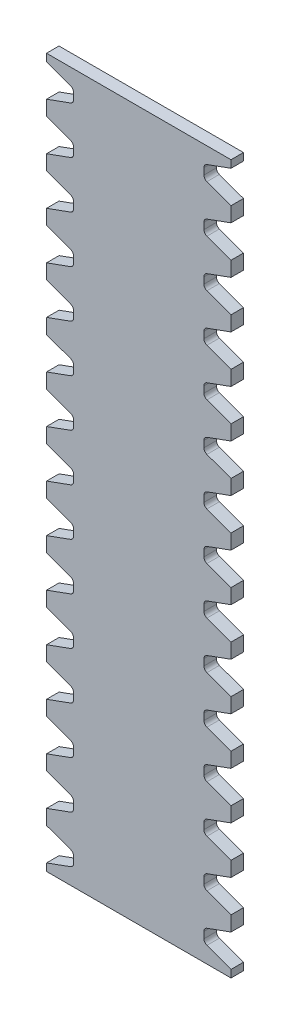
from build123d import *

# Parameters (mm, degrees)
SKETCHCI_M_STRSKETCHNAME_W         = 59.081695238
SKETCHCI_M_STRSKETCHNAME_H         = 453.902916577
EXTRUDECI_DEPTH                    = 4
TOOTHEXTRUDECUTGEARTRAX1GEAR_DEPTH = 4
PATTERNGEARTRAX1GEAR_COUNT         = 15
PATTERNGEARTRAX1GEAR_PITCH         = 30.260194893
MIRROR1_COPY_1_DEPTH               = 4
MIRROR1_COPY_2_DEPTH               = 4
MIRROR1_COPY_3_DEPTH               = 4
MIRROR1_COPY_4_DEPTH               = 4
MIRROR1_COPY_5_DEPTH               = 4
MIRROR1_COPY_6_DEPTH               = 4
MIRROR1_COPY_7_DEPTH               = 4
MIRROR1_COPY_8_DEPTH               = 4
MIRROR1_COPY_9_DEPTH               = 4
MIRROR1_COPY_10_DEPTH              = 4
MIRROR1_COPY_11_DEPTH              = 4
MIRROR1_COPY_12_DEPTH              = 4
MIRROR1_COPY_13_DEPTH              = 4
MIRROR1_COPY_14_DEPTH              = 4


with BuildPart() as part:
    # SketchCI.m_strSketchName → ExtrudeCI (new, symmetric)
    with BuildSketch(Plane.XY):
        with Locations((21.835152381, -211.82136107)):
            Rectangle(SKETCHCI_M_STRSKETCHNAME_W, SKETCHCI_M_STRSKETCHNAME_H)
    extrudeci = extrude(amount=EXTRUDECI_DEPTH, both=True)

    # SketchToothGeartrax1Gear → ToothExtrudeCutGeartrax1Gear (cut, symmetric)
    with BuildSketch(Plane.XY):
        with BuildLine():
            Line((-7.705695238, 10.369692311), (-7.705695238, -10.369692311))
            Line((-7.705695238, -10.369692311), (7.730796954, -4.751268631))
            ThreePointArc((7.730796954, -4.751268631), (9.109534336, -3.693326229), (9.632119048, -2.035899274))
            Line((9.632119048, -2.035899274), (9.632119048, 2.035899274))
            ThreePointArc((9.632119048, 2.035899274), (9.109534336, 3.693326229), (7.730796954, 4.751268631))
            Line((7.730796954, 4.751268631), (-7.705695238, 10.369692311))
        make_face()
    toothextrudecutgeartrax1gear = extrude(amount=TOOTHEXTRUDECUTGEARTRAX1GEAR_DEPTH, both=True, mode=Mode.SUBTRACT)

    # PatternGeartrax1Gear: ToothExtrudeCutGeartrax1Gear ×15
    with Locations(*[(0, -i * PATTERNGEARTRAX1GEAR_PITCH, 0) for i in range(1, PATTERNGEARTRAX1GEAR_COUNT)]):
        add(toothextrudecutgeartrax1gear, mode=Mode.SUBTRACT)

    # Mirror1: ExtrudeCI, ToothExtrudeCutGeartrax1Gear across plane
    add(extrudeci.mirror(Plane(origin=(51.376, -438.772819358, -4), x_dir=(0, 0, 1), z_dir=(1, 0, 0))))
    add(toothextrudecutgeartrax1gear.mirror(Plane(origin=(51.376, -438.772819358, -4), x_dir=(0, 0, 1), z_dir=(1, 0, 0))), mode=Mode.SUBTRACT)

    # Mirror1 copy 1 sketch → Mirror1 copy 1 (cut, symmetric)
    with BuildSketch(Plane(origin=(102.752, -30.260194893, 0), x_dir=(-1, 0, 0), z_dir=(0, 0, 1))):
        with BuildLine():
            Line((-7.705695238, -10.369692311), (-7.705695238, 10.369692311))
            Line((-7.705695238, 10.369692311), (7.730796954, 4.751268631))
            ThreePointArc((7.730796954, 4.751268631), (9.109534336, 3.693326229), (9.632119048, 2.035899274))
            Line((9.632119048, 2.035899274), (9.632119048, -2.035899274))
            ThreePointArc((9.632119048, -2.035899274), (9.109534336, -3.693326229), (7.730796954, -4.751268631))
            Line((7.730796954, -4.751268631), (-7.705695238, -10.369692311))
        make_face()
    extrude(amount=MIRROR1_COPY_1_DEPTH, both=True, mode=Mode.SUBTRACT)

    # Mirror1 copy 2 sketch → Mirror1 copy 2 (cut, symmetric)
    with BuildSketch(Plane(origin=(102.752, -60.520389786, 0), x_dir=(-1, 0, 0), z_dir=(0, 0, 1))):
        with BuildLine():
            Line((-7.705695238, -10.369692311), (-7.705695238, 10.369692311))
            Line((-7.705695238, 10.369692311), (7.730796954, 4.751268631))
            ThreePointArc((7.730796954, 4.751268631), (9.109534336, 3.693326229), (9.632119048, 2.035899274))
            Line((9.632119048, 2.035899274), (9.632119048, -2.035899274))
            ThreePointArc((9.632119048, -2.035899274), (9.109534336, -3.693326229), (7.730796954, -4.751268631))
            Line((7.730796954, -4.751268631), (-7.705695238, -10.369692311))
        make_face()
    extrude(amount=MIRROR1_COPY_2_DEPTH, both=True, mode=Mode.SUBTRACT)

    # Mirror1 copy 3 sketch → Mirror1 copy 3 (cut, symmetric)
    with BuildSketch(Plane(origin=(102.752, -90.780584679, 0), x_dir=(-1, 0, 0), z_dir=(0, 0, 1))):
        with BuildLine():
            Line((-7.705695238, -10.369692311), (-7.705695238, 10.369692311))
            Line((-7.705695238, 10.369692311), (7.730796954, 4.751268631))
            ThreePointArc((7.730796954, 4.751268631), (9.109534336, 3.693326229), (9.632119048, 2.035899274))
            Line((9.632119048, 2.035899274), (9.632119048, -2.035899274))
            ThreePointArc((9.632119048, -2.035899274), (9.109534336, -3.693326229), (7.730796954, -4.751268631))
            Line((7.730796954, -4.751268631), (-7.705695238, -10.369692311))
        make_face()
    extrude(amount=MIRROR1_COPY_3_DEPTH, both=True, mode=Mode.SUBTRACT)

    # Mirror1 copy 4 sketch → Mirror1 copy 4 (cut, symmetric)
    with BuildSketch(Plane(origin=(102.752, -121.040779572, 0), x_dir=(-1, 0, 0), z_dir=(0, 0, 1))):
        with BuildLine():
            Line((-7.705695238, -10.369692311), (-7.705695238, 10.369692311))
            Line((-7.705695238, 10.369692311), (7.730796954, 4.751268631))
            ThreePointArc((7.730796954, 4.751268631), (9.109534336, 3.693326229), (9.632119048, 2.035899274))
            Line((9.632119048, 2.035899274), (9.632119048, -2.035899274))
            ThreePointArc((9.632119048, -2.035899274), (9.109534336, -3.693326229), (7.730796954, -4.751268631))
            Line((7.730796954, -4.751268631), (-7.705695238, -10.369692311))
        make_face()
    extrude(amount=MIRROR1_COPY_4_DEPTH, both=True, mode=Mode.SUBTRACT)

    # Mirror1 copy 5 sketch → Mirror1 copy 5 (cut, symmetric)
    with BuildSketch(Plane(origin=(102.752, -151.300974465, 0), x_dir=(-1, 0, 0), z_dir=(0, 0, 1))):
        with BuildLine():
            Line((-7.705695238, -10.369692311), (-7.705695238, 10.369692311))
            Line((-7.705695238, 10.369692311), (7.730796954, 4.751268631))
            ThreePointArc((7.730796954, 4.751268631), (9.109534336, 3.693326229), (9.632119048, 2.035899274))
            Line((9.632119048, 2.035899274), (9.632119048, -2.035899274))
            ThreePointArc((9.632119048, -2.035899274), (9.109534336, -3.693326229), (7.730796954, -4.751268631))
            Line((7.730796954, -4.751268631), (-7.705695238, -10.369692311))
        make_face()
    extrude(amount=MIRROR1_COPY_5_DEPTH, both=True, mode=Mode.SUBTRACT)

    # Mirror1 copy 6 sketch → Mirror1 copy 6 (cut, symmetric)
    with BuildSketch(Plane(origin=(102.752, -181.561169358, 0), x_dir=(-1, 0, 0), z_dir=(0, 0, 1))):
        with BuildLine():
            Line((-7.705695238, -10.369692311), (-7.705695238, 10.369692311))
            Line((-7.705695238, 10.369692311), (7.730796954, 4.751268631))
            ThreePointArc((7.730796954, 4.751268631), (9.109534336, 3.693326229), (9.632119048, 2.035899274))
            Line((9.632119048, 2.035899274), (9.632119048, -2.035899274))
            ThreePointArc((9.632119048, -2.035899274), (9.109534336, -3.693326229), (7.730796954, -4.751268631))
            Line((7.730796954, -4.751268631), (-7.705695238, -10.369692311))
        make_face()
    extrude(amount=MIRROR1_COPY_6_DEPTH, both=True, mode=Mode.SUBTRACT)

    # Mirror1 copy 7 sketch → Mirror1 copy 7 (cut, symmetric)
    with BuildSketch(Plane(origin=(102.752, -211.821364251, 0), x_dir=(-1, 0, 0), z_dir=(0, 0, 1))):
        with BuildLine():
            Line((-7.705695238, -10.369692311), (-7.705695238, 10.369692311))
            Line((-7.705695238, 10.369692311), (7.730796954, 4.751268631))
            ThreePointArc((7.730796954, 4.751268631), (9.109534336, 3.693326229), (9.632119048, 2.035899274))
            Line((9.632119048, 2.035899274), (9.632119048, -2.035899274))
            ThreePointArc((9.632119048, -2.035899274), (9.109534336, -3.693326229), (7.730796954, -4.751268631))
            Line((7.730796954, -4.751268631), (-7.705695238, -10.369692311))
        make_face()
    extrude(amount=MIRROR1_COPY_7_DEPTH, both=True, mode=Mode.SUBTRACT)

    # Mirror1 copy 8 sketch → Mirror1 copy 8 (cut, symmetric)
    with BuildSketch(Plane(origin=(102.752, -242.081559144, 0), x_dir=(-1, 0, 0), z_dir=(0, 0, 1))):
        with BuildLine():
            Line((-7.705695238, -10.369692311), (-7.705695238, 10.369692311))
            Line((-7.705695238, 10.369692311), (7.730796954, 4.751268631))
            ThreePointArc((7.730796954, 4.751268631), (9.109534336, 3.693326229), (9.632119048, 2.035899274))
            Line((9.632119048, 2.035899274), (9.632119048, -2.035899274))
            ThreePointArc((9.632119048, -2.035899274), (9.109534336, -3.693326229), (7.730796954, -4.751268631))
            Line((7.730796954, -4.751268631), (-7.705695238, -10.369692311))
        make_face()
    extrude(amount=MIRROR1_COPY_8_DEPTH, both=True, mode=Mode.SUBTRACT)

    # Mirror1 copy 9 sketch → Mirror1 copy 9 (cut, symmetric)
    with BuildSketch(Plane(origin=(102.752, -272.341754037, 0), x_dir=(-1, 0, 0), z_dir=(0, 0, 1))):
        with BuildLine():
            Line((-7.705695238, -10.369692311), (-7.705695238, 10.369692311))
            Line((-7.705695238, 10.369692311), (7.730796954, 4.751268631))
            ThreePointArc((7.730796954, 4.751268631), (9.109534336, 3.693326229), (9.632119048, 2.035899274))
            Line((9.632119048, 2.035899274), (9.632119048, -2.035899274))
            ThreePointArc((9.632119048, -2.035899274), (9.109534336, -3.693326229), (7.730796954, -4.751268631))
            Line((7.730796954, -4.751268631), (-7.705695238, -10.369692311))
        make_face()
    extrude(amount=MIRROR1_COPY_9_DEPTH, both=True, mode=Mode.SUBTRACT)

    # Mirror1 copy 10 sketch → Mirror1 copy 10 (cut, symmetric)
    with BuildSketch(Plane(origin=(102.752, -302.60194893, 0), x_dir=(-1, 0, 0), z_dir=(0, 0, 1))):
        with BuildLine():
            Line((-7.705695238, -10.369692311), (-7.705695238, 10.369692311))
            Line((-7.705695238, 10.369692311), (7.730796954, 4.751268631))
            ThreePointArc((7.730796954, 4.751268631), (9.109534336, 3.693326229), (9.632119048, 2.035899274))
            Line((9.632119048, 2.035899274), (9.632119048, -2.035899274))
            ThreePointArc((9.632119048, -2.035899274), (9.109534336, -3.693326229), (7.730796954, -4.751268631))
            Line((7.730796954, -4.751268631), (-7.705695238, -10.369692311))
        make_face()
    extrude(amount=MIRROR1_COPY_10_DEPTH, both=True, mode=Mode.SUBTRACT)

    # Mirror1 copy 11 sketch → Mirror1 copy 11 (cut, symmetric)
    with BuildSketch(Plane(origin=(102.752, -332.862143823, 0), x_dir=(-1, 0, 0), z_dir=(0, 0, 1))):
        with BuildLine():
            Line((-7.705695238, -10.369692311), (-7.705695238, 10.369692311))
            Line((-7.705695238, 10.369692311), (7.730796954, 4.751268631))
            ThreePointArc((7.730796954, 4.751268631), (9.109534336, 3.693326229), (9.632119048, 2.035899274))
            Line((9.632119048, 2.035899274), (9.632119048, -2.035899274))
            ThreePointArc((9.632119048, -2.035899274), (9.109534336, -3.693326229), (7.730796954, -4.751268631))
            Line((7.730796954, -4.751268631), (-7.705695238, -10.369692311))
        make_face()
    extrude(amount=MIRROR1_COPY_11_DEPTH, both=True, mode=Mode.SUBTRACT)

    # Mirror1 copy 12 sketch → Mirror1 copy 12 (cut, symmetric)
    with BuildSketch(Plane(origin=(102.752, -363.122338716, 0), x_dir=(-1, 0, 0), z_dir=(0, 0, 1))):
        with BuildLine():
            Line((-7.705695238, -10.369692311), (-7.705695238, 10.369692311))
            Line((-7.705695238, 10.369692311), (7.730796954, 4.751268631))
            ThreePointArc((7.730796954, 4.751268631), (9.109534336, 3.693326229), (9.632119048, 2.035899274))
            Line((9.632119048, 2.035899274), (9.632119048, -2.035899274))
            ThreePointArc((9.632119048, -2.035899274), (9.109534336, -3.693326229), (7.730796954, -4.751268631))
            Line((7.730796954, -4.751268631), (-7.705695238, -10.369692311))
        make_face()
    extrude(amount=MIRROR1_COPY_12_DEPTH, both=True, mode=Mode.SUBTRACT)

    # Mirror1 copy 13 sketch → Mirror1 copy 13 (cut, symmetric)
    with BuildSketch(Plane(origin=(102.752, -393.382533609, 0), x_dir=(-1, 0, 0), z_dir=(0, 0, 1))):
        with BuildLine():
            Line((-7.705695238, -10.369692311), (-7.705695238, 10.369692311))
            Line((-7.705695238, 10.369692311), (7.730796954, 4.751268631))
            ThreePointArc((7.730796954, 4.751268631), (9.109534336, 3.693326229), (9.632119048, 2.035899274))
            Line((9.632119048, 2.035899274), (9.632119048, -2.035899274))
            ThreePointArc((9.632119048, -2.035899274), (9.109534336, -3.693326229), (7.730796954, -4.751268631))
            Line((7.730796954, -4.751268631), (-7.705695238, -10.369692311))
        make_face()
    extrude(amount=MIRROR1_COPY_13_DEPTH, both=True, mode=Mode.SUBTRACT)

    # Mirror1 copy 14 sketch → Mirror1 copy 14 (cut, symmetric)
    with BuildSketch(Plane(origin=(102.752, -423.642728502, 0), x_dir=(-1, 0, 0), z_dir=(0, 0, 1))):
        with BuildLine():
            Line((-7.705695238, -10.369692311), (-7.705695238, 10.369692311))
            Line((-7.705695238, 10.369692311), (7.730796954, 4.751268631))
            ThreePointArc((7.730796954, 4.751268631), (9.109534336, 3.693326229), (9.632119048, 2.035899274))
            Line((9.632119048, 2.035899274), (9.632119048, -2.035899274))
            ThreePointArc((9.632119048, -2.035899274), (9.109534336, -3.693326229), (7.730796954, -4.751268631))
            Line((7.730796954, -4.751268631), (-7.705695238, -10.369692311))
        make_face()
    extrude(amount=MIRROR1_COPY_14_DEPTH, both=True, mode=Mode.SUBTRACT)


solid = part.part
